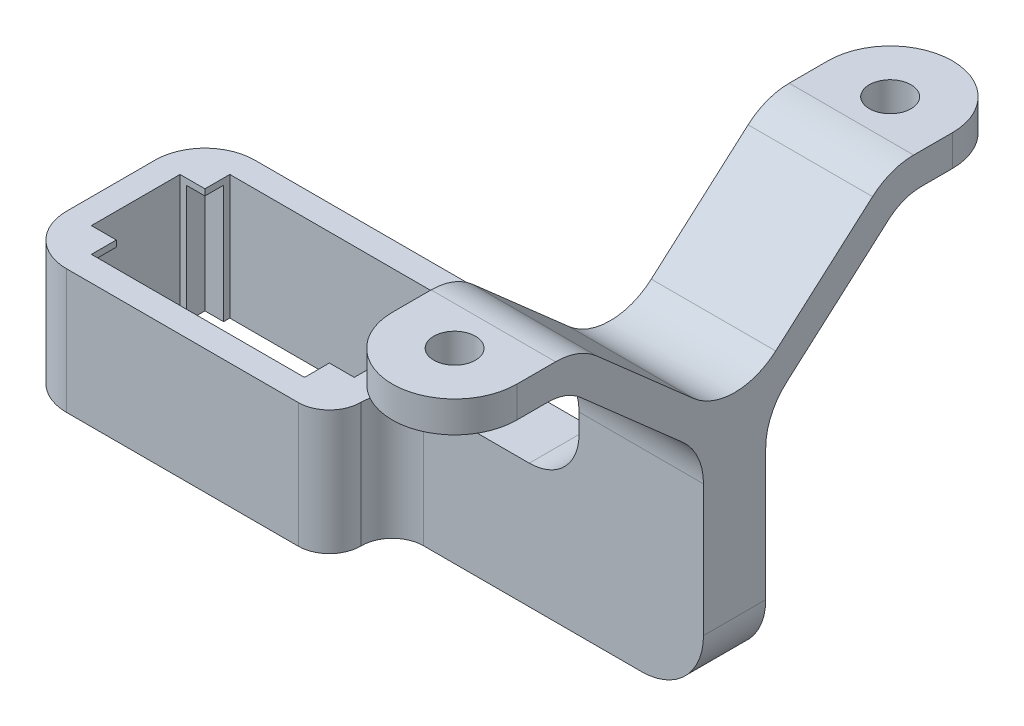
from build123d import *

# Parameters (mm, degrees)
BOSS_EXTRUDE1_DEPTH                   = 1
BOSS_EXTRUDE1_DEPTH_BACK              = 19
SKETCH1_W                             = 50.25
SKETCH1_H                             = 30.25
BOSS_EXTRUDE2_DEPTH                   = 5
BOSS_EXTRUDE3_DEPTH                   = 5
SKETCH4_R                             = 3.35
CUT_EXTRUDE1_DEPTH                    = 10
SKETCH6_W                             = 4
SKETCH6_H                             = 4
BOSS_EXTRUDE4_DEPTH                   = 1
TAP_DRILL_FOR_M4X0_7_TAP1_D           = 3.3
TAP_DRILL_FOR_M4X0_7_TAP1_CSINK_D     = 3.35
TAP_DRILL_FOR_M4X0_7_TAP1_CSINK_ANGLE = 90
SKETCH13_W                            = 20
SKETCH13_H                            = 50
CUT_EXTRUDE2_DEPTH                    = 22
BOSS_EXTRUDE5_DEPTH                   = 20
FILLET1_R                             = 10
FILLET2_R                             = 8
FILLET3_R                             = 5
FILLET4_R                             = 8


with BuildPart() as part:
    # Sketch1 → Boss-Extrude1 (new, two sides: drawn at the far end of the back side and taken through both)
    with BuildSketch(Plane(origin=(0, 20.13, 0), x_dir=(1, 0, 0), z_dir=(0, 1, 0)).offset(-BOSS_EXTRUDE1_DEPTH_BACK)):
        Rectangle(SKETCH1_W, SKETCH1_H)
        Polygon((20.125, 10.125), (17.125, 10.125), (17.125, 11.125), (-17.125, 11.125), (-17.125, 10.125), (-20.125, 10.125), (-20.125, 7.125), (-21.125, 7.125), (-21.125, -7.125), (-20.125, -7.125), (-20.125, -10.125), (-17.125, -10.125), (-17.125, -11.125), (17.125, -11.125), (17.125, -10.125), (20.125, -10.125), (20.125, -7.125), (21.125, -7.125), (21.125, 7.125), (20.125, 7.125), align=None, mode=Mode.SUBTRACT)
    extrude(amount=BOSS_EXTRUDE1_DEPTH + BOSS_EXTRUDE1_DEPTH_BACK)

    # Sketch2 → Boss-Extrude2 (add, symmetric)
    with BuildSketch(Plane.XY):
        Polygon((25.125, 21.13), (55.125, 21.13), (55.125, 61.13), (75.125, 61.13), (75.125, 1.13), (25.125, 1.13), align=None)
    extrude(amount=BOSS_EXTRUDE2_DEPTH, both=True)

    # Sketch3 → Boss-Extrude3 (add)
    with BuildSketch(Plane(origin=(0, 61.13, 0), x_dir=(1, 0, 0), z_dir=(0, 1, 0))):
        with BuildLine():
            Line((75.125, 5), (75.125, 35))
            ThreePointArc((75.125, 35), (65.125, 45), (55.125, 35))
            Line((55.125, 35), (55.125, 5))
            Line((55.125, 5), (75.125, 5))
        make_face()
        with BuildLine():
            Line((75.125, -35), (75.125, -5))
            Line((75.125, -5), (55.125, -5))
            Line((55.125, -5), (55.125, -35))
            ThreePointArc((55.125, -35), (65.125, -45), (75.125, -35))
        make_face()
    extrude(amount=-BOSS_EXTRUDE3_DEPTH)

    # Sketch4 → Cut-Extrude1 (cut)
    with BuildSketch(Plane.XZ.offset(-56.13)):
        with Locations(Location((65.125, 35, 0), (0, 0, 270))):
            Circle(SKETCH4_R)
        with Locations(Location((65.125, -35, 0), (0, 0, 270))):
            Circle(SKETCH4_R)
    extrude(amount=-CUT_EXTRUDE1_DEPTH, mode=Mode.SUBTRACT)

    # Sketch6 → Boss-Extrude4 (add)
    with BuildSketch(Plane(origin=(0, 21.13, 0), x_dir=(1, 0, 0), z_dir=(0, 1, 0))):
        with Locations((19.125, 9.125)):
            Rectangle(SKETCH6_W, SKETCH6_H)
        with Locations((19.125, -9.125)):
            Rectangle(SKETCH6_W, SKETCH6_H)
        with Locations((-19.125, -9.125)):
            Rectangle(SKETCH6_W, SKETCH6_H)
        with Locations((-19.125, 9.125)):
            Rectangle(SKETCH6_W, SKETCH6_H)
    extrude(amount=-BOSS_EXTRUDE4_DEPTH)

    # Tap Drill for M4x0.7 Tap1 (through all)
    with Locations(Plane(origin=(0, 1.13, 0), x_dir=(-1, 0, 0), z_dir=(0, -1, 0))):
        with Locations((-24.125, 0)):
            CounterSinkHole(TAP_DRILL_FOR_M4X0_7_TAP1_D / 2, TAP_DRILL_FOR_M4X0_7_TAP1_CSINK_D / 2, counter_sink_angle=TAP_DRILL_FOR_M4X0_7_TAP1_CSINK_ANGLE)

    # Sketch13 → Cut-Extrude2 (cut)
    with BuildSketch(Plane(origin=(0, 61.13, 0), x_dir=(1, 0, 0), z_dir=(0, 1, 0))):
        with Locations((65.125, 0)):
            Rectangle(SKETCH13_W, SKETCH13_H)
    extrude(amount=-CUT_EXTRUDE2_DEPTH, mode=Mode.SUBTRACT)


with BuildPart() as cut_extrude2_piece_1:
    # of the separate pieces the step leaves, piece 1, a body of its own (cut_extrude2_pieces)
    add(part.part.solids().sort_by_distance((25.125, 21.13, 15.125))[0])



with BuildPart() as cut_extrude2_piece_2:
    # of the separate pieces the step leaves, piece 2, a body of its own (cut_extrude2_pieces)
    add(part.part.solids().sort_by_distance((75.125, 56.13, -25))[0])


with BuildPart() as cut_extrude2_piece_3:
    # of the separate pieces the step leaves, piece 3, a body of its own (cut_extrude2_pieces)
    add(part.part.solids().sort_by_distance((75.125, 61.13, 25))[0])


with BuildPart() as cut_extrude2_piece_1_1:
    add(cut_extrude2_piece_1.part)

    add(cut_extrude2_piece_2.part)  # Boss-Extrude5 merges Cut-Extrude2 piece 2

    add(cut_extrude2_piece_3.part)  # Boss-Extrude5 merges Cut-Extrude2 piece 3
    # Sketch14 → Boss-Extrude5 (add)
    with BuildSketch(Plane(origin=(75.125, 0, 0), x_dir=(0, 0, -1), z_dir=(1, 0, 0))):
        Polygon((27, 56.13), (25, 56.13), (25, 61.13), (0, 39.13), (5, 39.13), (5, 36.77), align=None)
        Polygon((-5, 39.13), (0, 39.13), (-25, 61.13), (-25, 56.13), (-27, 56.13), (-5, 36.77), align=None)
    extrude(amount=-BOSS_EXTRUDE5_DEPTH)

    # Fillet1
    fillet1_edges = [cut_extrude2_piece_1_1.edges().sort_by_distance(p)[0] for p in [
        (75.125, 1.13, 0),
        (65.125, 36.77, -5),
        (65.125, 39.13, 0),
        (65.125, 61.13, -25),
        (65.125, 36.77, 5),
        (65.125, 61.13, 25),
    ]]
    fillet(fillet1_edges, radius=FILLET1_R)

    # Fillet2
    fillet2_edges = [cut_extrude2_piece_1_1.edges().sort_by_distance(p)[0] for p in [
        (65.125, 56.13, -27),
        (65.125, 56.13, 27),
    ]]
    fillet(fillet2_edges, radius=FILLET2_R)

    # Fillet3
    fillet3_edges = [cut_extrude2_piece_1_1.edges().sort_by_distance(p)[0] for p in [
        (25.125, 11.13, 5),
        (25.125, 11.13, 15.125),
        (25.125, 11.13, -5),
        (25.125, 11.13, -15.125),
    ]]
    fillet(fillet3_edges, radius=FILLET3_R)

    # Fillet4
    fillet4_edges = [cut_extrude2_piece_1_1.edges().sort_by_distance(p)[0] for p in [
        (55.125, 21.13, 0),
        (-25.125, 11.13, 15.125),
        (-25.125, 11.13, -15.125),
    ]]
    fillet(fillet4_edges, radius=FILLET4_R)


solid = cut_extrude2_piece_1_1.part
